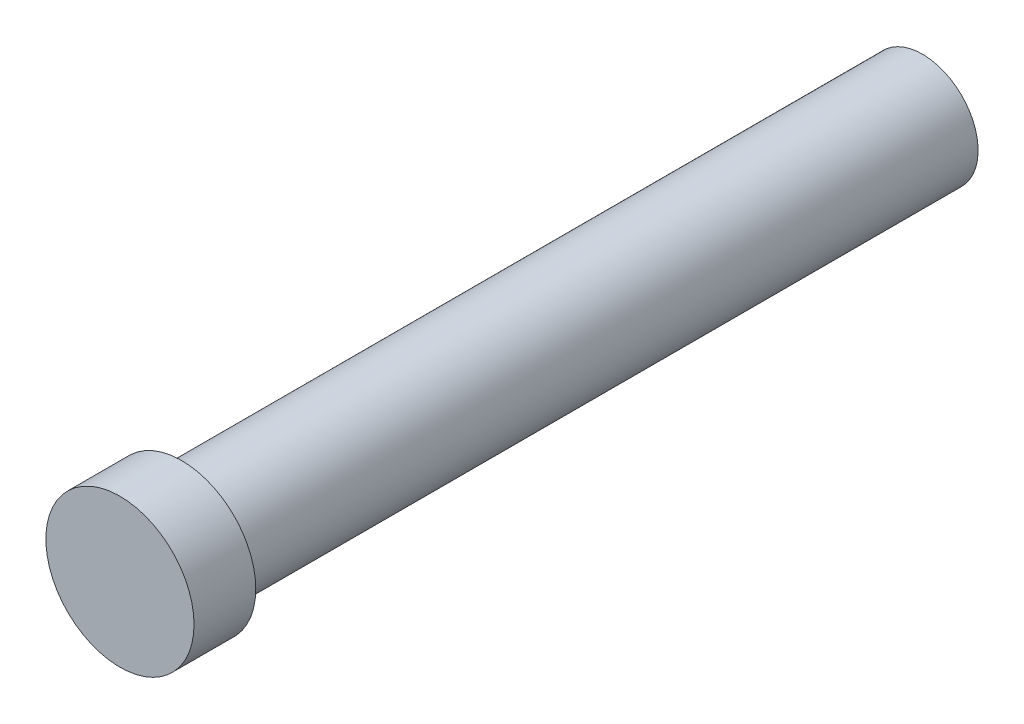
from build123d import *

# Parameters (mm, degrees)
SKETCH_1_R      = 6
EXTRUDE_1_DEPTH = 5
SKETCH_2_R      = 4.5
EXTRUDE_2_DEPTH = 60


with BuildPart() as part:
    # 草图1 → 凸台-拉伸1 (new body)
    with BuildSketch(Plane.XY):
        Circle(SKETCH_1_R)
    extrude(amount=EXTRUDE_1_DEPTH)

    # 草图2 → 凸台-拉伸2 (add)
    with BuildSketch(Plane(origin=(0, 0, 0), x_dir=(-1, 0, 0), z_dir=(0, 0, -1))):
        Circle(SKETCH_2_R)
    extrude(amount=EXTRUDE_2_DEPTH)


solid = part.part
